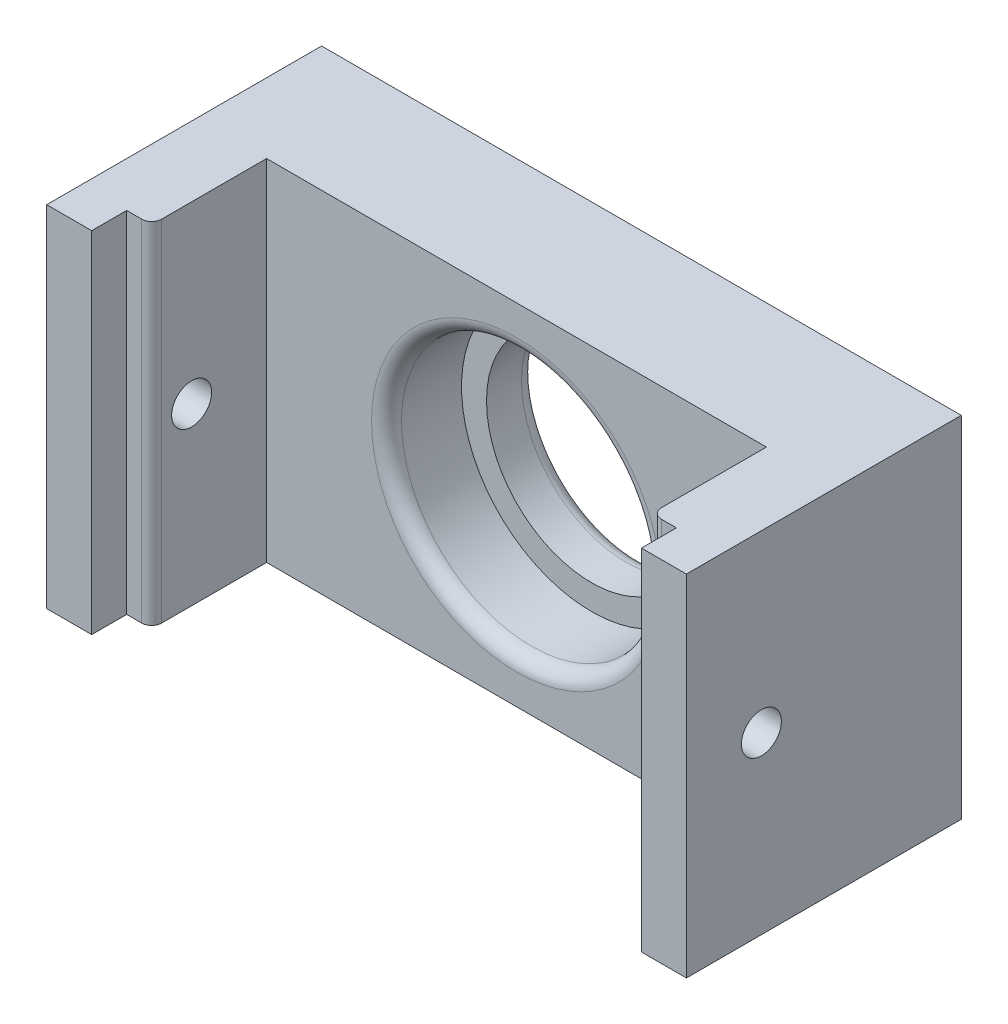
from build123d import *

# Parameters (mm, degrees)
DODANIE_WYCI_GNI_CIE1_DEPTH = 12.5
SZKIC3_R                    = 13
WYTNIJ_WYCI_GNI_CIE1_DEPTH  = 7.5
SZKIC4_W                    = 7
SZKIC4_H                    = 35
DODANIE_WYCI_GNI_CIE2_DEPTH = 15
SZKIC6_R                    = 2
WYTNIJ_WYCI_GNI_CIE2_DEPTH  = 7
WYTNIJ_WYCI_GNI_CIE3_START  = -7
SZKIC7_R                    = 2
WYTNIJ_WYCI_GNI_CIE3_DEPTH  = 7
ZAOKR_GLENIE2_R             = 1.5
ZAOKR_GLENIE3_R             = 1.5
SZKIC8_W                    = 2.5
SZKIC8_H                    = 35
WYTNIJ_WYCI_GNI_CIE4_DEPTH  = 3.5
ZAOKR_GLENIE4_R             = 1


with BuildPart() as part:
    # Szkic2 → Dodanie-wyciągnięcie1 (new body)
    with BuildSketch(Plane.XY):
        with BuildLine():
            ThreePointArc((0, -10.5), (-10.5, 0), (0, 10.5))
            Line((0, 10.5), (-32, 10.5))
            Line((-32, 10.5), (-32, -10.5))
            Line((-32, -10.5), (0, -10.5))
        make_face()
        with BuildLine():
            Line((32, 10.5), (0, 10.5))
            ThreePointArc((0, 10.5), (7.424621202, 7.424621202), (10.5, 0))
            ThreePointArc((10.5, 0), (7.424621202, -7.424621202), (0, -10.5))
            Line((0, -10.5), (32, -10.5))
            Line((32, -10.5), (32, 10.5))
        make_face()
        Polygon((0, 10.5), (32, 10.5), (32, 17.5), (-32, 17.5), (-32, 10.5), align=None)
        Polygon((32, -10.5), (32, -17.5), (-32, -17.5), (-32, -10.5), (0, -10.5), align=None)
    extrude(amount=DODANIE_WYCI_GNI_CIE1_DEPTH)

    # Szkic3 → Wytnij-wyciągnięcie1 (cut)
    with BuildSketch(Plane.XY.offset(12.5)):
        Circle(SZKIC3_R)
    extrude(amount=-WYTNIJ_WYCI_GNI_CIE1_DEPTH, mode=Mode.SUBTRACT)

    # Szkic4 → Dodanie-wyciągnięcie2 (add)
    with BuildSketch(Plane.XY.offset(12.5)):
        with Locations((-28.5, 0)):
            Rectangle(SZKIC4_W, SZKIC4_H)
        with Locations((28.5, 0)):
            Rectangle(SZKIC4_W, SZKIC4_H)
    extrude(amount=DODANIE_WYCI_GNI_CIE2_DEPTH)

    # Szkic6 → Wytnij-wyciągnięcie2 (cut)
    with BuildSketch(Plane.ZY.offset(-25)):
        with Locations(Location((20, 0, 0), (0, 0, 270))):
            Circle(SZKIC6_R)
    extrude(amount=-WYTNIJ_WYCI_GNI_CIE2_DEPTH, mode=Mode.SUBTRACT)

    # Szkic7 → Wytnij-wyciągnięcie3 (cut)
    with BuildSketch(Plane(origin=(-25, 0, 0), x_dir=(0, 0, -1), z_dir=(1, 0, 0)).offset(WYTNIJ_WYCI_GNI_CIE3_START)):
        with Locations(Location((-20, 0, 0), (0, 0, 270))):
            Circle(SZKIC7_R)
    extrude(amount=WYTNIJ_WYCI_GNI_CIE3_DEPTH, mode=Mode.SUBTRACT)

    # Zaokrąglenie2
    zaokr_glenie2_edges = [part.edges().sort_by_distance(p)[0] for p in [
        (-13, 0, 12.5),
    ]]
    fillet(zaokr_glenie2_edges, radius=ZAOKR_GLENIE2_R)

    # Zaokrąglenie3
    zaokr_glenie3_edges = [part.edges().sort_by_distance(p)[0] for p in [
        (0, 10.5, 0),
    ]]
    fillet(zaokr_glenie3_edges, radius=ZAOKR_GLENIE3_R)

    # Szkic8 → Wytnij-wyciągnięcie4 (cut)
    with BuildSketch(Plane.XY.offset(27.5)):
        with Locations((-26.25, 0)):
            Rectangle(SZKIC8_W, SZKIC8_H)
        with Locations((26.25, 0)):
            Rectangle(SZKIC8_W, SZKIC8_H)
    extrude(amount=-WYTNIJ_WYCI_GNI_CIE4_DEPTH, mode=Mode.SUBTRACT)

    # Zaokrąglenie4
    zaokr_glenie4_edges = [part.edges().sort_by_distance(p)[0] for p in [
        (-25, 0, 24),
        (25, 0, 24),
    ]]
    fillet(zaokr_glenie4_edges, radius=ZAOKR_GLENIE4_R)


solid = part.part
